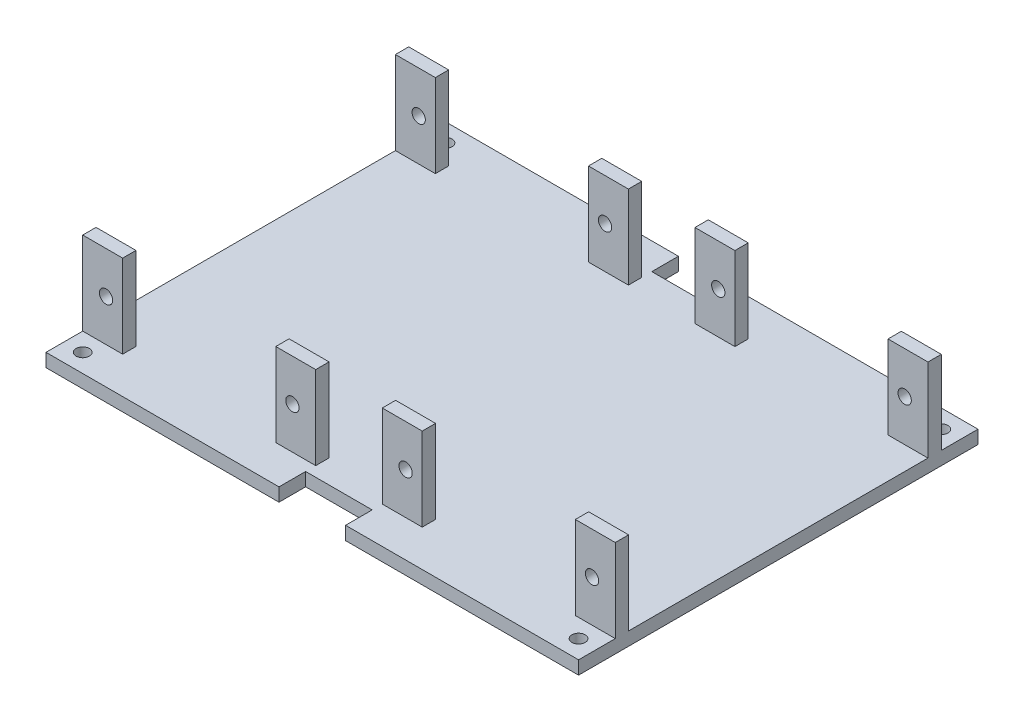
from build123d import *

# Parameters (mm, degrees)
SKETCH1_W               = 80
SKETCH1_H               = 60
BOSS_EXTRUDE1_DEPTH     = 2
SKETCH2_W               = 35
SKETCH2_H               = 2
BOSS_EXTRUDE2_DEPTH     = 12.5
CUT_EXTRUDE1_REACH      = 76.101
SKETCH3_R               = 1
SKETCH3_W               = 23
SKETCH3_H               = 12.5
MIRROR2_COPY_1_SKETCH_W = 35
MIRROR2_COPY_1_SKETCH_H = 2
MIRROR2_COPY_1_DEPTH    = 12.5
MIRROR2_COPY_2_REACH    = 76.101
MIRROR2_COPY_2_SKETCH_R = 1
MIRROR2_COPY_2_SKETCH_W = 23
MIRROR2_COPY_2_SKETCH_H = 12.5
CUT_EXTRUDE2_REACH      = 74.376
SKETCH4_R               = 1
MIRROR4_COPY_1_REACH    = 74.376
MIRROR4_COPY_1_SKETCH_R = 1
SKETCH5_W               = 10
SKETCH5_H               = 4
CUT_EXTRUDE3_DEPTH      = 10


with BuildPart() as part:
    # Sketch1 → Boss-Extrude1 (new body)
    with BuildSketch(Plane(origin=(0, 0, 0), x_dir=(1, 0, 0), z_dir=(0, 1, 0))):
        with Locations((8.084510341, -22.630080351)):
            Rectangle(SKETCH1_W, SKETCH1_H)
    extrude(amount=BOSS_EXTRUDE1_DEPTH)

    # Sketch2 → Boss-Extrude2 (add)
    with BuildSketch(Plane(origin=(0, 2, 0), x_dir=(1, 0, 0), z_dir=(0, 1, 0))):
        with Locations((-14.415489659, -46.114303401)):
            Rectangle(SKETCH2_W, SKETCH2_H)
    boss_extrude2 = extrude(amount=BOSS_EXTRUDE2_DEPTH)

    # Sketch3 → Cut-Extrude1 (cut, up to next)
    with BuildSketch(Plane.XY.offset(47.114303401), mode=Mode.PRIVATE) as cut_extrude1_sk1:
        with Locations((-0.415489659, 8.25)):
            Circle(SKETCH3_R)
    cut_extrude1_tool1 = extrude(cut_extrude1_sk1.sketch, amount=-CUT_EXTRUDE1_REACH, mode=Mode.PRIVATE) & part.part
    # Sketch3 → Cut-Extrude1 (cut, up to next)
    with BuildSketch(Plane.XY.offset(47.114303401), mode=Mode.PRIVATE) as cut_extrude1_sk2:
        with Locations((-28.415489659, 8.25)):
            Circle(SKETCH3_R)
    cut_extrude1_tool2 = extrude(cut_extrude1_sk2.sketch, amount=-CUT_EXTRUDE1_REACH, mode=Mode.PRIVATE) & part.part
    # Sketch3 → Cut-Extrude1 (cut, up to next)
    with BuildSketch(Plane.XY.offset(47.114303401), mode=Mode.PRIVATE) as cut_extrude1_sk3:
        with Locations((-14.415489659, 8.25)):
            Rectangle(SKETCH3_W, SKETCH3_H)
    cut_extrude1_tool3 = extrude(cut_extrude1_sk3.sketch, amount=-CUT_EXTRUDE1_REACH, mode=Mode.PRIVATE) & part.part
    cut_extrude1_1 = cut_extrude1_tool1.solids().sort_by_distance((-0.41549, 8.25, 47.114303))[0]
    add(cut_extrude1_1, mode=Mode.SUBTRACT)
    cut_extrude1_2 = cut_extrude1_tool2.solids().sort_by_distance((-28.41549, 8.25, 47.114303))[0]
    add(cut_extrude1_2, mode=Mode.SUBTRACT)
    cut_extrude1_3 = cut_extrude1_tool3.solids().sort_by_distance((-14.41549, 8.25, 47.114303))[0]
    add(cut_extrude1_3, mode=Mode.SUBTRACT)
    cut_extrude1 = cut_extrude1_1 + cut_extrude1_2 + cut_extrude1_3  # Cut-Extrude1 as one shape, for the pattern or mirror that repeats it

    # Mirror1: Boss-Extrude2, Cut-Extrude1 across plane
    add(boss_extrude2.mirror(Plane(origin=(8.084510341, 0, 0), x_dir=(0, 0, 1), z_dir=(1, 0, 0))))
    add(cut_extrude1.mirror(Plane(origin=(8.084510341, 0, 0), x_dir=(0, 0, 1), z_dir=(1, 0, 0))), mode=Mode.SUBTRACT)

    # Mirror2: Boss-Extrude2, Cut-Extrude1 across plane
    add(boss_extrude2.mirror(Plane.XY.offset(22.630080351)))
    add(cut_extrude1.mirror(Plane.XY.offset(22.630080351)), mode=Mode.SUBTRACT)

    # Mirror2 copy 1 sketch → Mirror2 copy 1 (add)
    with BuildSketch(Plane(origin=(16.169020682, 2, 45.260160703), x_dir=(-1, 0, 0), z_dir=(0, 1, 0))):
        with Locations((-14.415489659, -46.114303401)):
            Rectangle(MIRROR2_COPY_1_SKETCH_W, MIRROR2_COPY_1_SKETCH_H)
    extrude(amount=MIRROR2_COPY_1_DEPTH)

    # Mirror2 copy 2 sketch → Mirror2 copy 2 (cut, up to next)
    with BuildSketch(Plane(origin=(16.169020682, 0, -1.854142699), x_dir=(-1, 0, 0), z_dir=(0, 0, -1)), mode=Mode.PRIVATE) as mirror2_copy_2_sk1:
        with Locations((-0.415489659, 8.25)):
            Circle(MIRROR2_COPY_2_SKETCH_R)
    mirror2_copy_2_tool1 = extrude(mirror2_copy_2_sk1.sketch, amount=-MIRROR2_COPY_2_REACH, mode=Mode.PRIVATE) & part.part
    # Mirror2 copy 2 sketch → Mirror2 copy 2 (cut, up to next)
    with BuildSketch(Plane(origin=(16.169020682, 0, -1.854142699), x_dir=(-1, 0, 0), z_dir=(0, 0, -1)), mode=Mode.PRIVATE) as mirror2_copy_2_sk2:
        with Locations((-28.415489659, 8.25)):
            Circle(MIRROR2_COPY_2_SKETCH_R)
    mirror2_copy_2_tool2 = extrude(mirror2_copy_2_sk2.sketch, amount=-MIRROR2_COPY_2_REACH, mode=Mode.PRIVATE) & part.part
    # Mirror2 copy 2 sketch → Mirror2 copy 2 (cut, up to next)
    with BuildSketch(Plane(origin=(16.169020682, 0, -1.854142699), x_dir=(-1, 0, 0), z_dir=(0, 0, -1)), mode=Mode.PRIVATE) as mirror2_copy_2_sk3:
        with Locations((-14.415489659, 8.25)):
            Rectangle(MIRROR2_COPY_2_SKETCH_W, MIRROR2_COPY_2_SKETCH_H)
    mirror2_copy_2_tool3 = extrude(mirror2_copy_2_sk3.sketch, amount=-MIRROR2_COPY_2_REACH, mode=Mode.PRIVATE) & part.part
    add(mirror2_copy_2_tool1.solids().sort_by_distance((16.584510682, 8.25, -1.854142297))[0], mode=Mode.SUBTRACT)
    add(mirror2_copy_2_tool2.solids().sort_by_distance((44.584510682, 8.25, -1.854142297))[0], mode=Mode.SUBTRACT)
    add(mirror2_copy_2_tool3.solids().sort_by_distance((30.584510682, 8.25, -1.854142297))[0], mode=Mode.SUBTRACT)

    # Sketch4 → Cut-Extrude2 (cut, up to next)
    with BuildSketch(Plane(origin=(0, 2, 0), x_dir=(1, 0, 0), z_dir=(0, 1, 0)), mode=Mode.PRIVATE) as cut_extrude2_sk1:
        with Locations(Location((-29.155489659, -49.872191876, 0), (0, 0, 270))):
            Circle(SKETCH4_R)
    cut_extrude2_tool1 = extrude(cut_extrude2_sk1.sketch, amount=-CUT_EXTRUDE2_REACH, mode=Mode.PRIVATE) & part.part
    cut_extrude2 = cut_extrude2_tool1.solids().sort_by_distance((-29.15549, 2, 49.872192))[0]
    add(cut_extrude2, mode=Mode.SUBTRACT)

    # Mirror3: Cut-Extrude2 across plane
    add(cut_extrude2.mirror(Plane(origin=(8.084510341, 0, 0), x_dir=(0, 0, 1), z_dir=(1, 0, 0))), mode=Mode.SUBTRACT)

    # Mirror4: Cut-Extrude2 across plane
    add(cut_extrude2.mirror(Plane.XY.offset(22.630080351)), mode=Mode.SUBTRACT)

    # Mirror4 copy 1 sketch → Mirror4 copy 1 (cut, up to next)
    with BuildSketch(Plane(origin=(16.169020682, 2, 45.260160703), x_dir=(-1, 0, 0), z_dir=(0, 1, 0)), mode=Mode.PRIVATE) as mirror4_copy_1_sk1:
        with Locations(Location((-29.155489659, -49.872191876, 0), (0, 0, 270))):
            Circle(MIRROR4_COPY_1_SKETCH_R)
    mirror4_copy_1_tool1 = extrude(mirror4_copy_1_sk1.sketch, amount=-MIRROR4_COPY_1_REACH, mode=Mode.PRIVATE) & part.part
    add(mirror4_copy_1_tool1.solids().sort_by_distance((45.324510682, 2, -4.612031297))[0], mode=Mode.SUBTRACT)

    # Sketch5 → Cut-Extrude3 (cut)
    with BuildSketch(Plane(origin=(0, 2, 0), x_dir=(1, 0, 0), z_dir=(0, 1, 0))):
        with Locations((8.084510341, 5.369919649)):
            Rectangle(SKETCH5_W, SKETCH5_H)
    cut_extrude3 = extrude(amount=-CUT_EXTRUDE3_DEPTH, mode=Mode.SUBTRACT)

    # Mirror5: Cut-Extrude3 across plane
    add(cut_extrude3.mirror(Plane.XY.offset(22.630080351)), mode=Mode.SUBTRACT)


solid = part.part
